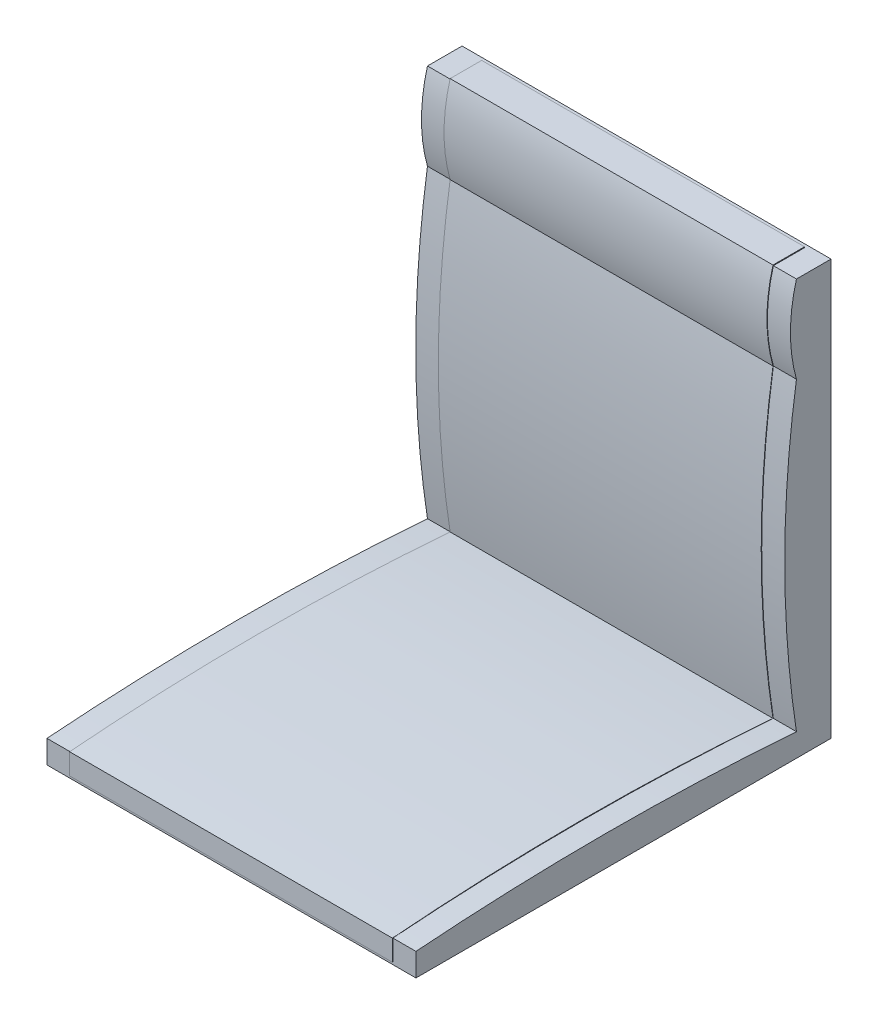
from build123d import *

# Parameters (mm, degrees)
BOSS_EXTRUDE1_START  = 406.4
SKETCH2_W            = 406.4
SKETCH2_H            = 457.2
BOSS_EXTRUDE1_DEPTH  = 25.4
SKETCH5_W            = 406.4
SKETCH5_H            = 38.1
BOSS_EXTRUDE2_DEPTH  = 431.8
BOSS_EXTRUDE3_DEPTH  = 406.4
BOSS_EXTRUDE5_DEPTH  = 406.4
BOSS_EXTRUDE6_DEPTH  = 406.4
BOSS_EXTRUDE8_START  = -25.4
BOSS_EXTRUDE8_DEPTH  = 355.6
BOSS_EXTRUDE10_DEPTH = 12.7


with BuildPart() as part:
    # Sketch2 → Boss-Extrude1 (new body)
    with BuildSketch(Plane(origin=(0, 0, 0), x_dir=(1, 0, 0), z_dir=(0, 1, 0)).offset(BOSS_EXTRUDE1_START)):
        Rectangle(SKETCH2_W, SKETCH2_H)
    extrude(amount=BOSS_EXTRUDE1_DEPTH)

    # Sketch5 → Boss-Extrude2 (add)
    with BuildSketch(Plane(origin=(0, 431.8, 0), x_dir=(1, 0, 0), z_dir=(0, 1, 0))):
        with Locations((0, 209.55)):
            Rectangle(SKETCH5_W, SKETCH5_H)
    extrude(amount=BOSS_EXTRUDE2_DEPTH)

    # Sketch6 → Boss-Extrude3 (add)
    with BuildSketch(Plane(origin=(203.2, 0, 0), x_dir=(0, 0, -1), z_dir=(1, 0, 0))):
        with BuildLine():
            Line((190.5, 431.8), (228.6, 431.8))
            Line((228.6, 431.8), (228.6, 863.6))
            Line((228.6, 863.6), (209.55, 863.6))
            ThreePointArc((209.55, 863.6), (178.726471845, 648.639640948), (190.5, 431.8))
        make_face()
    extrude(amount=-BOSS_EXTRUDE3_DEPTH)

    # Sketch7 → Boss-Extrude5 (add)
    with BuildSketch(Plane(origin=(203.2, 0, 0), x_dir=(0, 0, -1), z_dir=(1, 0, 0))):
        with BuildLine():
            Line((-228.6, 431.8), (-228.6, 406.4))
            Line((-228.6, 406.4), (190.5, 406.4))
            Line((190.5, 406.4), (190.5, 431.8))
            ThreePointArc((190.5, 431.8), (-19.05, 439.760210116), (-228.6, 431.8))
        make_face()
    extrude(amount=-BOSS_EXTRUDE5_DEPTH)

    # Sketch8 → Boss-Extrude6 (add)
    with BuildSketch(Plane(origin=(203.2, 0, 0), x_dir=(0, 0, -1), z_dir=(1, 0, 0))):
        with BuildLine():
            Line((190.5, 863.6), (228.6, 863.6))
            Line((228.6, 863.6), (228.6, 767.986138045))
            Line((228.6, 767.986138045), (190.5, 767.986138045))
            ThreePointArc((190.5, 767.986138045), (183.89577559, 815.793069023), (190.5, 863.6))
        make_face()
    extrude(amount=-BOSS_EXTRUDE6_DEPTH)

    # Sketch9 → Boss-Extrude8 (add)
    with BuildSketch(Plane(origin=(203.2, 0, 0), x_dir=(0, 0, -1), z_dir=(1, 0, 0)).offset(BOSS_EXTRUDE8_START)):
        with BuildLine():
            Line((190.064521118, 864.483944692), (224.793246745, 864.483944692))
            Line((224.793246745, 864.483944692), (224.793246745, 863.6))
            Line((224.793246745, 863.6), (224.793246745, 408.97647982))
            Line((224.793246745, 408.97647982), (-229.126005902, 408.97647982))
            Line((-229.126005902, 408.97647982), (-229.126005902, 432.005066032))
            ThreePointArc((-229.126005902, 432.005066032), (-19.530742392, 440.435933777), (190.064521118, 432.005066032))
            ThreePointArc((190.064521118, 432.005066032), (177.09008034, 600.056508721), (190.064521118, 768.10795141))
            ThreePointArc((190.064521118, 768.10795141), (183.373440165, 816.295948051), (190.064521118, 864.483944692))
        make_face()
    extrude(amount=-BOSS_EXTRUDE8_DEPTH)

    # Sketch11 → Boss-Extrude10 (add)
    with BuildSketch(Plane.XZ.offset(-406.4)):
        Polygon((0, 0), (0, 1.931960206), (-1.331020628, 0), align=None)
    extrude(amount=BOSS_EXTRUDE10_DEPTH)


solid = part.part
